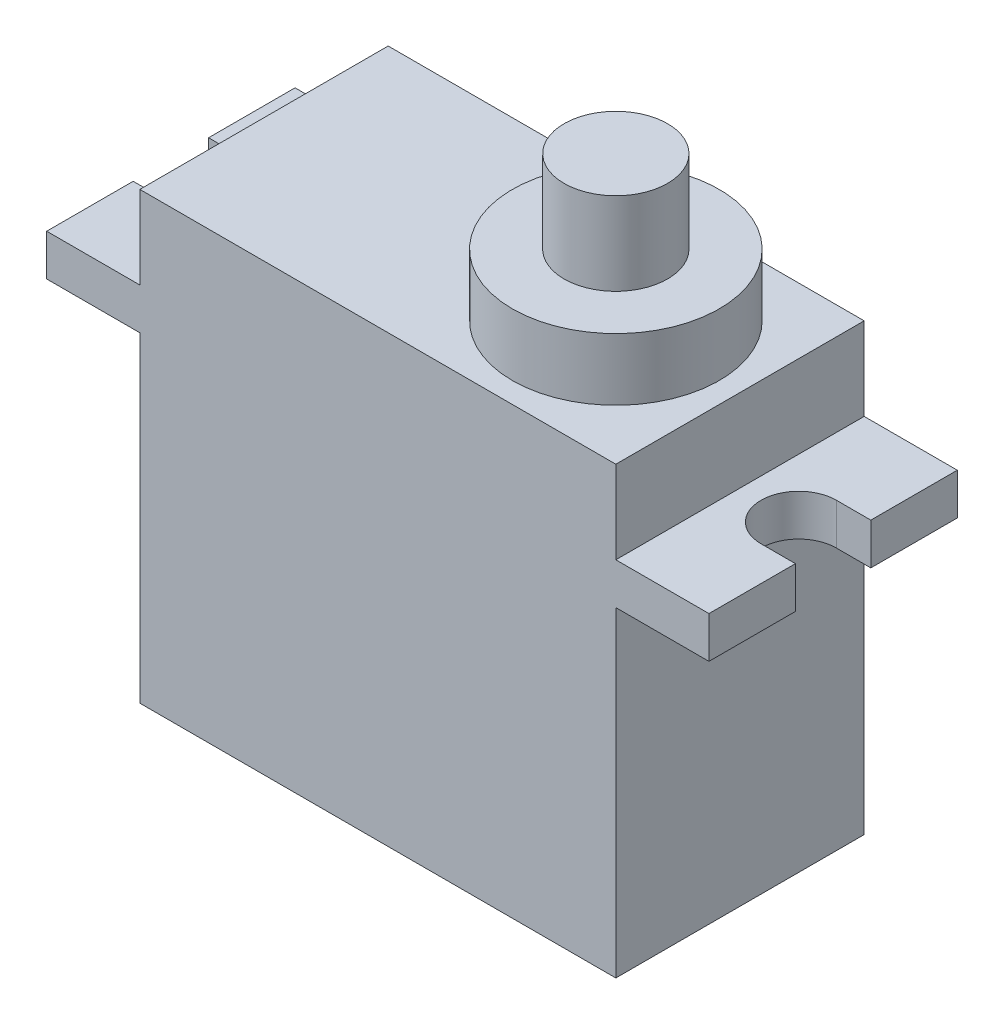
from build123d import *

# Parameters (mm, degrees)
SKETCH1_W           = 23
SKETCH1_H           = 21.5
BOSS_EXTRUDE1_DEPTH = 12
SKETCH4_W           = 32
SKETCH4_H           = 12
BOSS_EXTRUDE2_DEPTH = 2
SKETCH5_R           = 5
BOSS_EXTRUDE3_DEPTH = 3
SKETCH6_R           = 2.5
BOSS_EXTRUDE4_DEPTH = 4
CUT_EXTRUDE1_DEPTH  = 4


with BuildPart() as part:
    # Sketch1 → Boss-Extrude1 (new body)
    with BuildSketch(Plane.XY):
        Rectangle(SKETCH1_W, SKETCH1_H)
    extrude(amount=BOSS_EXTRUDE1_DEPTH)

    # Sketch4 → Boss-Extrude2 (add)
    with BuildSketch(Plane(origin=(0, 6.75, 0), x_dir=(1, 0, 0), z_dir=(0, 1, 0))):
        with Locations((0, -6)):
            Rectangle(SKETCH4_W, SKETCH4_H)
    extrude(amount=-BOSS_EXTRUDE2_DEPTH)

    # Sketch5 → Boss-Extrude3 (add)
    with BuildSketch(Plane(origin=(0, 10.75, 0), x_dir=(1, 0, 0), z_dir=(0, 1, 0))):
        with Locations(Location((5.5, -6, 0), (0, 0, 270))):
            Circle(SKETCH5_R)
    extrude(amount=BOSS_EXTRUDE3_DEPTH)

    # Sketch6 → Boss-Extrude4 (add)
    with BuildSketch(Plane(origin=(0, 13.75, 0), x_dir=(1, 0, 0), z_dir=(0, 1, 0))):
        with Locations(Location((5.5, -6, 0), (0, 0, 270))):
            Circle(SKETCH6_R)
    extrude(amount=BOSS_EXTRUDE4_DEPTH)

    # Sketch7 → Cut-Extrude1 (cut)
    with BuildSketch(Plane(origin=(0, 6.75, 0), x_dir=(1, 0, 0), z_dir=(0, 1, 0))):
        with BuildLine():
            Line((-16, -4.178738648), (-14.337589365, -4.178738648))
            ThreePointArc((-14.337589365, -4.178738648), (-12.516328014, -6), (-14.337589365, -7.821261352))
            Line((-14.337589365, -7.821261352), (-16, -7.821261352))
            ThreePointArc((-16, -7.821261352), (-17.821261352, -6), (-16, -4.178738648))
        make_face()
        with BuildLine():
            Line((16, -4.178738648), (14.337589365, -4.178738648))
            ThreePointArc((14.337589365, -4.178738648), (12.516328014, -6), (14.337589365, -7.821261352))
            Line((14.337589365, -7.821261352), (16, -7.821261352))
            ThreePointArc((16, -7.821261352), (17.821261352, -6), (16, -4.178738648))
        make_face()
    extrude(amount=-CUT_EXTRUDE1_DEPTH, mode=Mode.SUBTRACT)


solid = part.part
